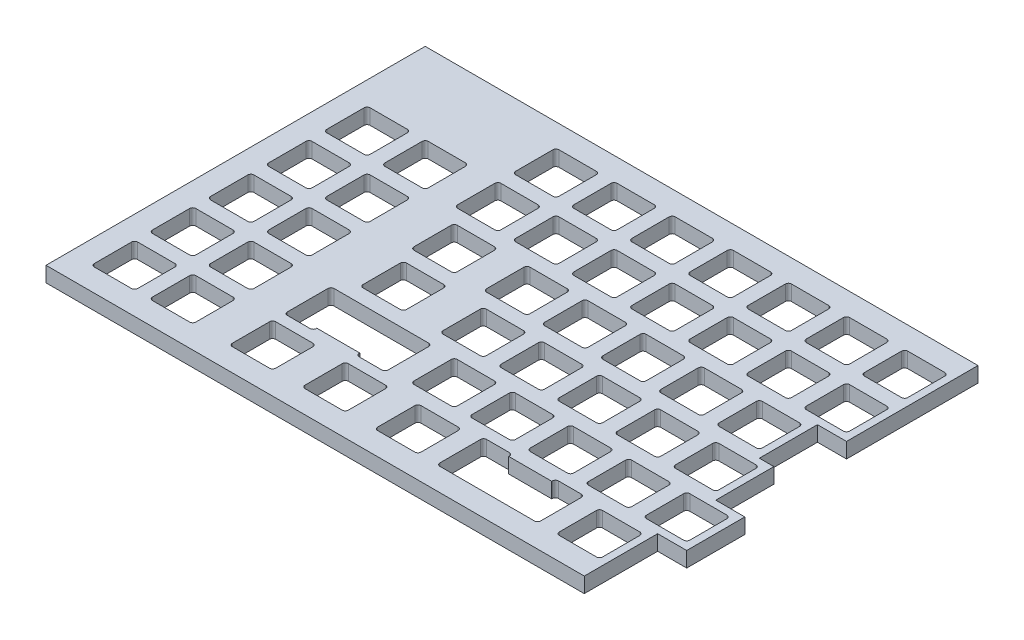
from build123d import *

# Parameters (mm, degrees)
PLATE_FRAME_DEPTH    = 5
CUT_EXTRUDE_1U_DEPTH = 224.745817
CUT_EXTRUDE1_DEPTH   = 224.745817
CUT_EXTRUDE2_DEPTH   = 224.745817


with BuildPart() as part:
    # Sketch1 → Plate Frame (new body)
    with BuildSketch(Plane(origin=(0, 0, 0), x_dir=(1, 0, 0), z_dir=(0, 1, 0))):
        Polygon((0, 0), (0, 124.3), (181.2125, 124.3), (181.2125, 81.2), (171.6875, 81.2), (171.6875, 62.15), (176.45, 62.15), (176.45, 43.1), (185.975, 43.1), (185.975, 24.05), (176.45, 24.05), (176.45, 0), align=None)
    extrude(amount=PLATE_FRAME_DEPTH)

    # Sketch2 → Cut-Extrude 1U (cut, through all)
    with BuildSketch(Plane(origin=(0, 5, 0), x_dir=(1, 0, 0), z_dir=(0, 1, 0))):
        with BuildLine():
            Line((7.425, 8.425), (7.425, 20.625))
            ThreePointArc((7.425, 20.625), (7.717893219, 21.332106781), (8.425, 21.625))
            Line((8.425, 21.625), (20.625, 21.625))
            ThreePointArc((20.625, 21.625), (21.332106781, 21.332106781), (21.625, 20.625))
            Line((21.625, 20.625), (21.625, 8.425))
            ThreePointArc((21.625, 8.425), (21.332106781, 7.717893219), (20.625, 7.425))
            Line((20.625, 7.425), (8.425, 7.425))
            ThreePointArc((8.425, 7.425), (7.717893219, 7.717893219), (7.425, 8.425))
        make_face()
    cut_extrude_1u = extrude(amount=-CUT_EXTRUDE_1U_DEPTH, mode=Mode.SUBTRACT)

    # Sketch-Pattern1: Cut-Extrude 1U at 44 more places
    with Locations((19.05, 0, 0), (19.05, 0, -19.05), (0, 0, -19.05), (0, 0, -38.1), (19.05, 0, -38.1), (19.05, 0, -57.15), (0, 0, -57.15), (0, 0, -76.2), (19.05, 0, -76.2), (42.8625, 0, -95.25), (42.8625, 0, -76.2), (61.9125, 0, -76.2), (61.9125, 0, -95.25), (80.9625, 0, -95.25), (80.9625, 0, -76.2), (100.0125, 0, -76.2), (100.0125, 0, -95.25), (119.0625, 0, -95.25), (119.0625, 0, -76.2), (138.1125, 0, -76.2), (138.1125, 0, -95.25), (157.1625, 0, -95.25), (157.1625, 0, -76.2), (71.4375, 0, -57.15), (47.625, 0, -57.15), (90.4875, 0, -57.15), (109.5375, 0, -57.15), (128.5875, 0, -57.15), (147.6375, 0, -57.15), (76.2, 0, -38.1), (95.25, 0, -38.1), (114.3, 0, -38.1), (133.35, 0, -38.1), (152.4, 0, -38.1), (85.725, 0, -19.05), (104.775, 0, -19.05), (123.825, 0, -19.05), (142.875, 0, -19.05), (161.925, 0, -19.05), (69.05625, 0, 0), (92.86875, 0, 0), (50.00625, 0, -38.1), (152.4, 0, 0), (45.24375, 0, 0)):
        add(cut_extrude_1u, mode=Mode.SUBTRACT)

    # Sketch6 → Cut-Extrude1 (cut, through all)
    with BuildSketch(Plane(origin=(0, 5, 0), x_dir=(1, 0, 0), z_dir=(0, 1, 0))):
        with BuildLine():
            Line((52.79375, 26.325), (52.79375, 39.625))
            ThreePointArc((52.79375, 39.625), (53.086643219, 40.332106781), (53.79375, 40.625))
            Line((53.79375, 40.625), (84.79375, 40.625))
            ThreePointArc((84.79375, 40.625), (85.500856781, 40.332106781), (85.79375, 39.625))
            Line((85.79375, 39.625), (85.79375, 26.325))
            ThreePointArc((85.79375, 26.325), (85.500856781, 25.617893219), (84.79375, 25.325))
            Line((84.79375, 25.325), (77.34375, 25.325))
            ThreePointArc((77.34375, 25.325), (76.636643219, 25.617893219), (76.34375, 26.325))
            Line((76.34375, 26.325), (76.34375, 26.525))
            Line((76.34375, 26.525), (62.24375, 26.525))
            Line((62.24375, 26.525), (62.24375, 26.325))
            ThreePointArc((62.24375, 26.325), (61.950856781, 25.617893219), (61.24375, 25.325))
            Line((61.24375, 25.325), (53.79375, 25.325))
            ThreePointArc((53.79375, 25.325), (53.086643219, 25.617893219), (52.79375, 26.325))
        make_face()
    extrude(amount=-CUT_EXTRUDE1_DEPTH, mode=Mode.SUBTRACT)

    # Sketch7 → Cut-Extrude2 (cut, through all)
    with BuildSketch(Plane(origin=(0, 5, 0), x_dir=(1, 0, 0), z_dir=(0, 1, 0))):
        with BuildLine():
            Line((121.659375, 7.475), (152.659375, 7.475))
            ThreePointArc((152.659375, 7.475), (153.366481781, 7.767893219), (153.659375, 8.475))
            Line((153.659375, 8.475), (153.659375, 21.775))
            ThreePointArc((153.659375, 21.775), (153.366481781, 22.482106781), (152.659375, 22.775))
            Line((152.659375, 22.775), (145.209375, 22.775))
            ThreePointArc((145.209375, 22.775), (144.502268219, 22.482106781), (144.209375, 21.775))
            Line((144.209375, 21.775), (144.209375, 21.575))
            Line((144.209375, 21.575), (130.109375, 21.575))
            Line((130.109375, 21.575), (130.109375, 21.775))
            ThreePointArc((130.109375, 21.775), (129.816481781, 22.482106781), (129.109375, 22.775))
            Line((129.109375, 22.775), (121.659375, 22.775))
            ThreePointArc((121.659375, 22.775), (120.952268219, 22.482106781), (120.659375, 21.775))
            Line((120.659375, 21.775), (120.659375, 8.475))
            ThreePointArc((120.659375, 8.475), (120.952268219, 7.767893219), (121.659375, 7.475))
        make_face()
    extrude(amount=-CUT_EXTRUDE2_DEPTH, mode=Mode.SUBTRACT)


solid = part.part
